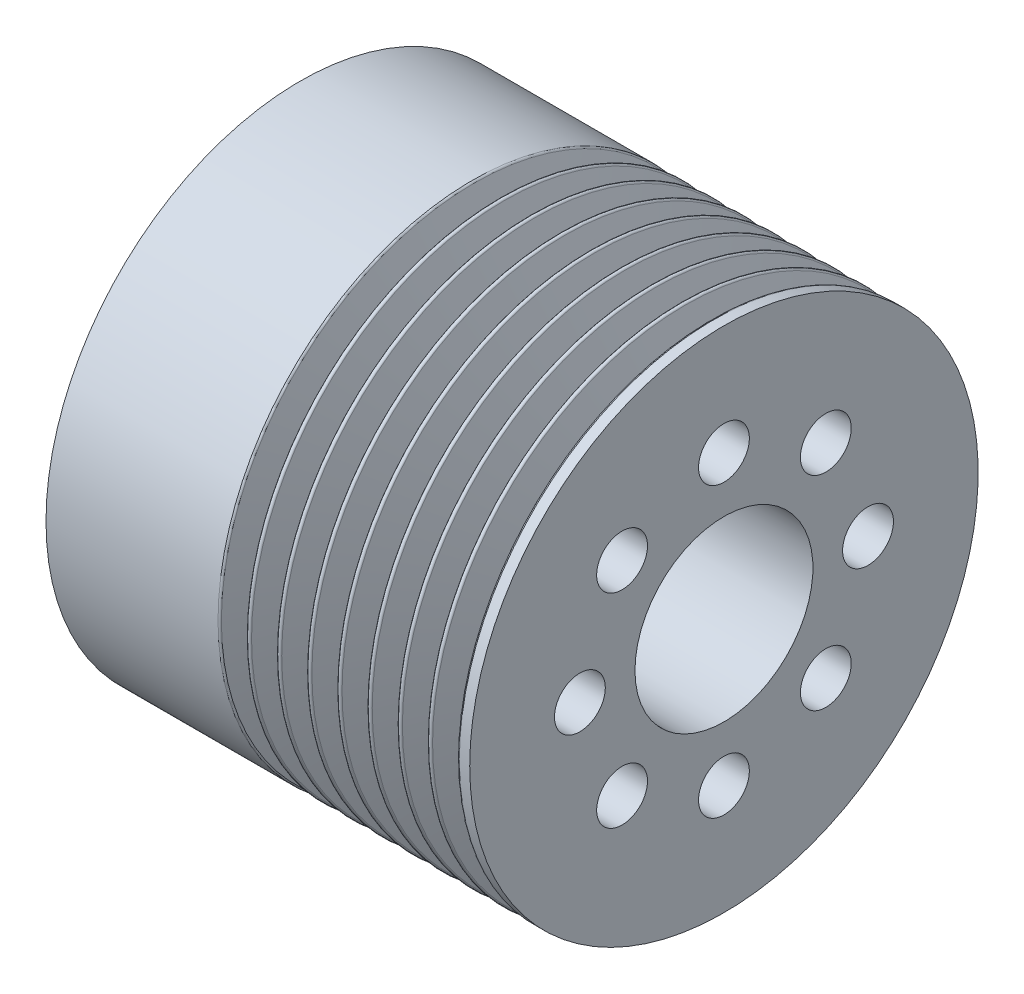
from build123d import *

# Parameters (mm, degrees)
LPATTERN1_COUNT    = 8
LPATTERN1_PITCH    = 3.56
SKETCH3_R          = 3
CUT_EXTRUDE1_DEPTH = 17.5


with BuildPart() as part:
    # Sketch1 → Revolve1 (revolve)
    with BuildSketch(Plane.XY, mode=Mode.PRIVATE) as revolve1_sk:
        Polygon((49, 10.5), (49, 30), (-1, 30), (-1, 21.5), (31.5, 21.5), (31.5, 10.5), align=None)
    revolve(revolve1_sk.sketch.rotate(Axis((0, 0, 0), (1, 0, 0)), 90), axis=Axis((0, 0, 0), (1, 0, 0)))

    # Sketch2 → Cut-Revolve1 (revolve, cut)
    with BuildSketch(Plane.XY, mode=Mode.PRIVATE) as cut_revolve1_sk:
        with BuildLine():
            Line((47.545831953, 29.837551845), (46.281001657, 26.45460955))
            ThreePointArc((46.281001657, 26.45460955), (46, 26.259671764), (45.718998343, 26.45460955))
            Line((45.718998343, 26.45460955), (44.454168047, 29.837551845))
            ThreePointArc((44.454168047, 29.837551845), (44.362499191, 29.955411734), (44.22, 30))
            Line((44.22, 30), (47.78, 30))
            ThreePointArc((47.78, 30), (47.637500809, 29.955411734), (47.545831953, 29.837551845))
        make_face()
    cut_revolve1 = revolve(cut_revolve1_sk.sketch.rotate(Axis((0, 0, 0), (1, 0, 0)), 90), axis=Axis((0, 0, 0), (1, 0, 0)), mode=Mode.SUBTRACT)

    # LPattern1: Cut-Revolve1 ×8
    with Locations(*[(-i * LPATTERN1_PITCH, 0, 0) for i in range(1, LPATTERN1_COUNT)]):
        add(cut_revolve1, mode=Mode.SUBTRACT)

    # Sketch3 → Cut-Extrude1 (cut)
    with BuildSketch(Plane(origin=(49, 0, 0), x_dir=(0, 0, -1), z_dir=(1, 0, 0))):
        with Locations((0, 17)):
            Circle(SKETCH3_R)
        with Locations((12.02081528, 12.02081528)):
            Circle(SKETCH3_R)
        with Locations((17, 0)):
            Circle(SKETCH3_R)
        with Locations((12.02081528, -12.02081528)):
            Circle(SKETCH3_R)
        with Locations((0, -17)):
            Circle(SKETCH3_R)
        with Locations((-12.02081528, -12.02081528)):
            Circle(SKETCH3_R)
        with Locations((-17, 0)):
            Circle(SKETCH3_R)
        with Locations((-12.02081528, 12.02081528)):
            Circle(SKETCH3_R)
    extrude(amount=-CUT_EXTRUDE1_DEPTH, mode=Mode.SUBTRACT)


solid = part.part
